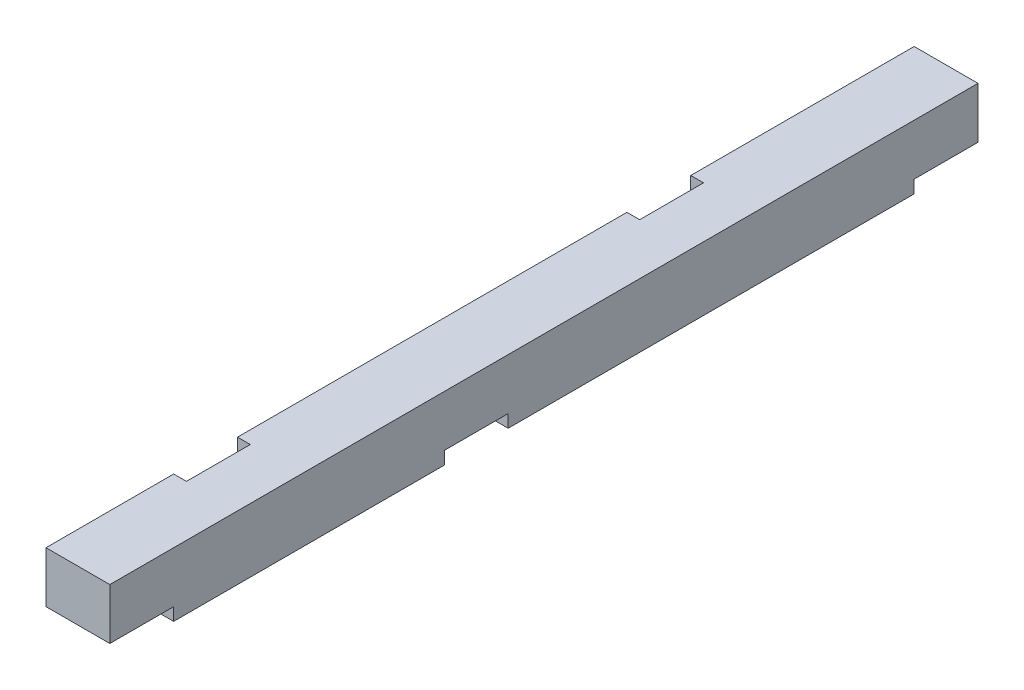
from build123d import *

# Parameters (mm, degrees)
ESQUISSE1_W             = 10
ESQUISSE1_H             = 10
BOSS_EXTRU_1_DEPTH      = 136
ESQUISSE2_W             = 10
ESQUISSE2_H             = 2
ENL_V_MAT_EXTRU_1_DEPTH = 137.733317081
ESQUISSE3_W             = 10
ESQUISSE3_H             = 10
ENL_V_MAT_EXTRU_2_DEPTH = 2
ESQUISSE4_W             = 10
ESQUISSE4_H             = 10
ENL_V_MAT_EXTRU_3_DEPTH = 2


with BuildPart() as part:
    # Esquisse1 → Boss.-Extru.1 (new body)
    with BuildSketch(Plane.XY):
        with Locations((5, 5)):
            Rectangle(ESQUISSE1_W, ESQUISSE1_H)
    extrude(amount=BOSS_EXTRU_1_DEPTH)

    # Esquisse2 → Enlèv. mat.-Extru.1 (cut, through all)
    with BuildSketch(Plane(origin=(10, 0, 0), x_dir=(0, 0, -1), z_dir=(1, 0, 0))):
        with Locations((-131, 1)):
            Rectangle(ESQUISSE2_W, ESQUISSE2_H)
        with Locations((-78.6, 1)):
            Rectangle(ESQUISSE2_W, ESQUISSE2_H)
        with Locations((-5, 1)):
            Rectangle(ESQUISSE2_W, ESQUISSE2_H)
    extrude(amount=-ENL_V_MAT_EXTRU_1_DEPTH, mode=Mode.SUBTRACT)

    # Esquisse3 → Enlèv. mat.-Extru.2 (cut)
    with BuildSketch(Plane.ZY):
        with Locations((40, 5)):
            Rectangle(ESQUISSE3_W, ESQUISSE3_H)
    extrude(amount=-ENL_V_MAT_EXTRU_2_DEPTH, mode=Mode.SUBTRACT)

    # Esquisse4 → Enlèv. mat.-Extru.3 (cut)
    with BuildSketch(Plane.ZY):
        with Locations((111, 5)):
            Rectangle(ESQUISSE4_W, ESQUISSE4_H)
    extrude(amount=-ENL_V_MAT_EXTRU_3_DEPTH, mode=Mode.SUBTRACT)


solid = part.part
